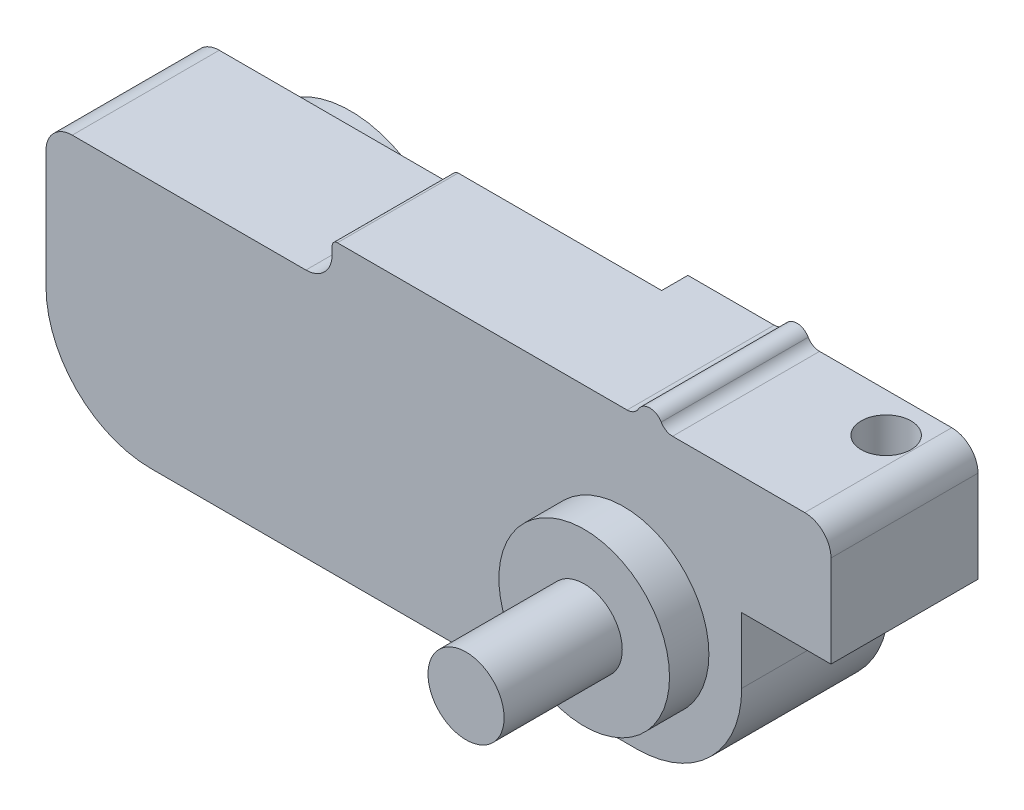
from build123d import *

# Parameters (mm, degrees)
SKETCH1_W           = 29.9
SKETCH1_H           = 11
BOSS_EXTRUDE1_DEPTH = 5.6
SKETCH2_R           = 4
BOSS_EXTRUDE2_DEPTH = 2
CUT_EXTRUDE1_START  = -5.6
CUT_EXTRUDE1_DEPTH  = 5.6
SKETCH5_R           = 3.25
BOSS_EXTRUDE3_DEPTH = 1.5
SKETCH6_R           = 1.45
BOSS_EXTRUDE4_DEPTH = 4.5
SKETCH7_W           = 3.4
SKETCH7_H           = 6.5
CUT_EXTRUDE2_DEPTH  = 5.6
FILLET2_R           = 4
SKETCH8_R           = 0.5
BOSS_EXTRUDE5_DEPTH = 5.6
FILLET3_R           = 0.5
SKETCH9_R           = 0.95
CUT_EXTRUDE3_DEPTH  = 4.5
FILLET5_R           = 1
SKETCH10_W          = 10.9
SKETCH10_H          = 1.5
CUT_EXTRUDE4_DEPTH  = 5.6
FILLET6_R           = 1
FILLET7_R           = 1
FILLET8_R           = 0.2
SKETCH11_W          = 9.2
SKETCH11_H          = 3.7
CUT_EXTRUDE5_DEPTH  = 1
FILLET9_R           = 2
BOSS_EXTRUDE6_DEPTH = 0.4
FILLET10_R          = 1


with BuildPart() as part:
    # Sketch1 → Boss-Extrude1 (new body)
    with BuildSketch(Plane.XY):
        with Locations((44.023400912, -0.002506593)):
            Rectangle(SKETCH1_W, SKETCH1_H)
    extrude(amount=BOSS_EXTRUDE1_DEPTH)

    # Sketch2 → Boss-Extrude2 (add)
    with BuildSketch(Plane(origin=(0, 0, 0), x_dir=(-1, 0, 0), z_dir=(0, 0, -1))):
        with Locations((-33.073400912, -1.502506593)):
            Circle(SKETCH2_R)
    extrude(amount=BOSS_EXTRUDE2_DEPTH)

    # Sketch4 → Cut-Extrude1 (cut)
    with BuildSketch(Plane(origin=(0, 0, 0), x_dir=(-1, 0, 0), z_dir=(0, 0, -1)).offset(CUT_EXTRUDE1_START)):
        with BuildLine():
            Line((-29.073400912, -1.502506593), (-29.073400912, -5.502506593))
            Line((-29.073400912, -5.502506593), (-33.073400912, -5.502506593))
            ThreePointArc((-33.073400912, -5.502506593), (-30.244973787, -4.330933718), (-29.073400912, -1.502506593))
        make_face()
    extrude(amount=CUT_EXTRUDE1_DEPTH, mode=Mode.SUBTRACT)

    # Sketch5 → Boss-Extrude3 (add)
    with BuildSketch(Plane.XY.offset(5.6)):
        with Locations((51.073400912, -1.002506593)):
            Circle(SKETCH5_R)
    extrude(amount=BOSS_EXTRUDE3_DEPTH)

    # Sketch6 → Boss-Extrude4 (add)
    with BuildSketch(Plane.XY.offset(7.1)):
        with Locations((51.073400912, -1.002506593)):
            Circle(SKETCH6_R)
    extrude(amount=BOSS_EXTRUDE4_DEPTH)

    # Sketch7 → Cut-Extrude2 (cut)
    with BuildSketch(Plane.XY.offset(5.6)):
        with Locations((57.273400912, -2.252506593)):
            Rectangle(SKETCH7_W, SKETCH7_H)
    extrude(amount=-CUT_EXTRUDE2_DEPTH, mode=Mode.SUBTRACT)

    # Fillet2
    fillet2_edges = [part.edges().sort_by_distance(p)[0] for p in [
        (55.573400912, -5.502506593, 2.8),
    ]]
    fillet(fillet2_edges, radius=FILLET2_R)

    # Sketch8 → Boss-Extrude5 (add)
    with BuildSketch(Plane.XY.offset(5.6)):
        with Locations((52.073400912, 5.497493407)):
            Circle(SKETCH8_R)
    extrude(amount=-BOSS_EXTRUDE5_DEPTH)

    # Fillet3
    fillet3_edges = [part.edges().sort_by_distance(p)[0] for p in [
        (52.573400912, 5.497493407, 2.8),
        (51.573400912, 5.497493407, 2.8),
    ]]
    fillet(fillet3_edges, radius=FILLET3_R)

    # Sketch9 → Cut-Extrude3 (cut)
    with BuildSketch(Plane.XZ.offset(-0.997493407)):
        with Locations((56.973400912, 1.5)):
            Circle(SKETCH9_R)
    extrude(amount=-CUT_EXTRUDE3_DEPTH, mode=Mode.SUBTRACT)

    # Fillet5
    fillet5_edges = [part.edges().sort_by_distance(p)[0] for p in [
        (58.973400912, 5.497493407, 2.8),
    ]]
    fillet(fillet5_edges, radius=FILLET5_R)

    # Sketch10 → Cut-Extrude4 (cut)
    with BuildSketch(Plane.XY.offset(5.6)):
        with Locations((34.523400912, 4.747493407)):
            Rectangle(SKETCH10_W, SKETCH10_H)
    extrude(amount=-CUT_EXTRUDE4_DEPTH, mode=Mode.SUBTRACT)

    # Fillet6
    fillet6_edges = [part.edges().sort_by_distance(p)[0] for p in [
        (29.073400912, 3.997493407, 2.8),
    ]]
    fillet(fillet6_edges, radius=FILLET6_R)

    # Fillet7
    fillet7_edges = [part.edges().sort_by_distance(p)[0] for p in [
        (39.973400912, 3.997493407, 2.8),
    ]]
    fillet(fillet7_edges, radius=FILLET7_R)

    # Fillet8
    fillet8_edges = [part.edges().sort_by_distance(p)[0] for p in [
        (39.973400912, 5.497493407, 2.8),
    ]]
    fillet(fillet8_edges, radius=FILLET8_R)

    # Sketch11 → Cut-Extrude5 (cut)
    with BuildSketch(Plane(origin=(0, 0, 0), x_dir=(-1, 0, 0), z_dir=(0, 0, -1))):
        with Locations((-43.323400912, 3.647493407)):
            Rectangle(SKETCH11_W, SKETCH11_H)
    extrude(amount=-CUT_EXTRUDE5_DEPTH, mode=Mode.SUBTRACT)

    # Fillet9
    fillet9_edges = [part.edges().sort_by_distance(p)[0] for p in [
        (47.923400912, 1.797493407, 0.5),
    ]]
    fillet(fillet9_edges, radius=FILLET9_R)

    # Sketch12 → Boss-Extrude6 (add)
    with BuildSketch(Plane(origin=(0, 0, 0), x_dir=(-1, 0, 0), z_dir=(0, 0, -1))):
        with BuildLine():
            Line((-37.073400912, -1.502506593), (-38.744359598, -1.502506593))
            Line((-38.744359598, -1.502506593), (-38.744359598, -4.080351874))
            Line((-38.744359598, -4.080351874), (-36.537502527, -3.502506593))
            ThreePointArc((-36.537502527, -3.502506593), (-36.937104217, -2.537782773), (-37.073400912, -1.502506593))
        make_face()
    extrude(amount=BOSS_EXTRUDE6_DEPTH)

    # Fillet10
    fillet10_edges = [part.edges().sort_by_distance(p)[0] for p in [
        (38.744359598, -1.502506593, -0.2),
        (38.744359598, -4.080351874, -0.2),
    ]]
    fillet(fillet10_edges, radius=FILLET10_R)


solid = part.part
